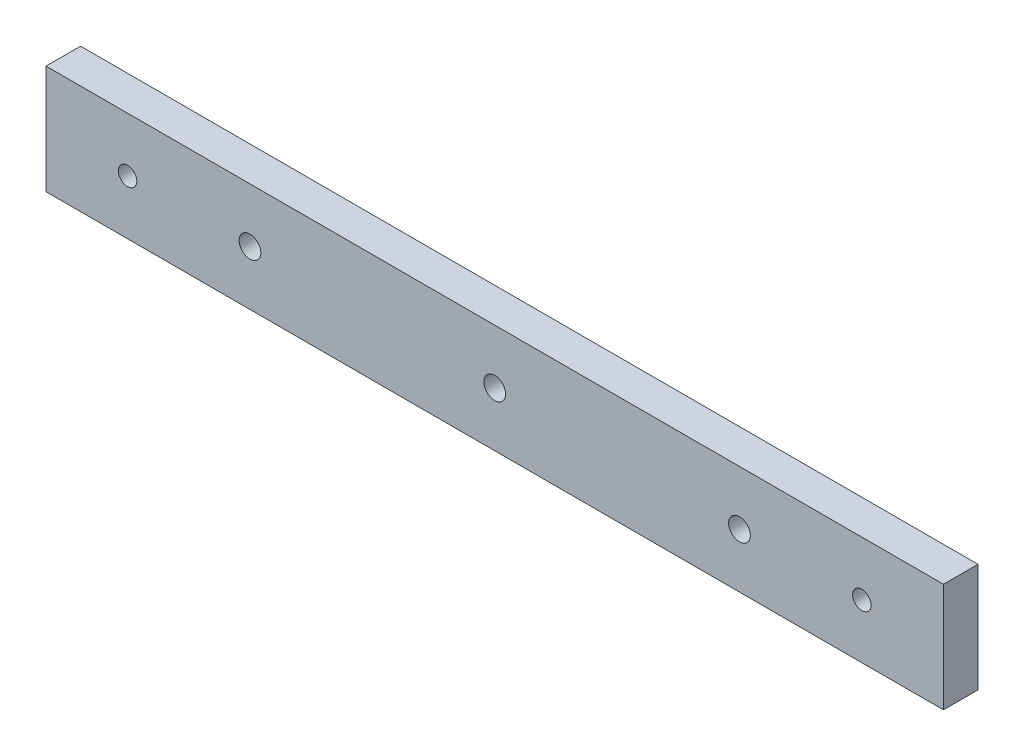
from build123d import *

# Parameters (mm, degrees)
SKETCH1_W           = 165
SKETCH1_H           = 20
SKETCH1_R           = 1.7
BOSS_EXTRUDE1_DEPTH = 6.35
CUT_EXTRUDE2_DEPTH  = 3.35
CUT_EXTRUDE3_DEPTH  = 3


with BuildPart() as part:
    # Sketch1 → Boss-Extrude1 (new body)
    with BuildSketch(Plane(origin=(0, 0, 0), x_dir=(-1, 0, 0), z_dir=(0, 0, 1))):
        with Locations((52.952306935, 12.575384489)):
            Rectangle(SKETCH1_W, SKETCH1_H)
        with Locations(Location((120.452306935, 12.575384489, 0), (0, 0, 180))):
            Circle(SKETCH1_R, mode=Mode.SUBTRACT)
        with Locations(Location((-14.547693065, 12.575384489, 0), (0, 0, 180))):
            Circle(SKETCH1_R, mode=Mode.SUBTRACT)
    extrude(amount=BOSS_EXTRUDE1_DEPTH)

    # Sketch3 → Cut-Extrude2 (cut)
    with BuildSketch(Plane(origin=(0, 0, 0), x_dir=(-1, 0, 0), z_dir=(0, 0, -1))):
        with BuildLine():
            Line((56.502306935, -16.125384489), (49.402306935, -16.125384489))
            ThreePointArc((49.402306935, -16.125384489), (45.852306935, -12.575384489), (49.402306935, -9.025384489))
            Line((49.402306935, -9.025384489), (56.502306935, -9.025384489))
            ThreePointArc((56.502306935, -9.025384489), (60.052306935, -12.575384489), (56.502306935, -16.125384489))
        make_face()
        with BuildLine():
            Line((101.502306935, -16.125384489), (94.402306935, -16.125384489))
            ThreePointArc((94.402306935, -16.125384489), (90.852306935, -12.575384489), (94.402306935, -9.025384489))
            Line((94.402306935, -9.025384489), (101.502306935, -9.025384489))
            ThreePointArc((101.502306935, -9.025384489), (105.052306935, -12.575384489), (101.502306935, -16.125384489))
        make_face()
        with BuildLine():
            Line((11.502306935, -16.125384489), (4.402306935, -16.125384489))
            ThreePointArc((4.402306935, -16.125384489), (0.852306935, -12.575384489), (4.402306935, -9.025384489))
            Line((4.402306935, -9.025384489), (11.502306935, -9.025384489))
            ThreePointArc((11.502306935, -9.025384489), (15.052306935, -12.575384489), (11.502306935, -16.125384489))
        make_face()
    extrude(amount=-CUT_EXTRUDE2_DEPTH, mode=Mode.SUBTRACT)

    # Sketch4 → Cut-Extrude3 (cut)
    with BuildSketch(Plane(origin=(0, 0, 3.35), x_dir=(-1, 0, 0), z_dir=(0, 0, -1))):
        with BuildLine():
            ThreePointArc((9.952306935, -12.575384489), (9.366520498, -11.161170927), (7.952306935, -10.575384489))
            Line((7.952306935, -10.575384489), (7.952306935, -14.575384489))
            ThreePointArc((7.952306935, -14.575384489), (9.366520498, -13.989598052), (9.952306935, -12.575384489))
        make_face()
        with BuildLine():
            Line((7.952306935, -14.575384489), (7.952306935, -10.575384489))
            ThreePointArc((7.952306935, -10.575384489), (5.952306935, -12.575384489), (7.952306935, -14.575384489))
        make_face()
        with BuildLine():
            ThreePointArc((52.952306935, -10.575384489), (50.952306935, -12.575384489), (52.952306935, -14.575384489))
            Line((52.952306935, -14.575384489), (52.952306935, -10.575384489))
        make_face()
        with BuildLine():
            Line((52.952306935, -10.575384489), (52.952306935, -14.575384489))
            ThreePointArc((52.952306935, -14.575384489), (54.366520498, -13.989598052), (54.952306935, -12.575384489))
            ThreePointArc((54.952306935, -12.575384489), (54.366520498, -11.161170927), (52.952306935, -10.575384489))
        make_face()
        with BuildLine():
            ThreePointArc((99.952306935, -12.575384489), (99.366520498, -11.161170927), (97.952306935, -10.575384489))
            Line((97.952306935, -10.575384489), (97.952306935, -14.575384489))
            ThreePointArc((97.952306935, -14.575384489), (99.366520498, -13.989598052), (99.952306935, -12.575384489))
        make_face()
        with BuildLine():
            Line((97.952306935, -14.575384489), (97.952306935, -10.575384489))
            ThreePointArc((97.952306935, -10.575384489), (95.952306935, -12.575384489), (97.952306935, -14.575384489))
        make_face()
    extrude(amount=-CUT_EXTRUDE3_DEPTH, mode=Mode.SUBTRACT)


solid = part.part
